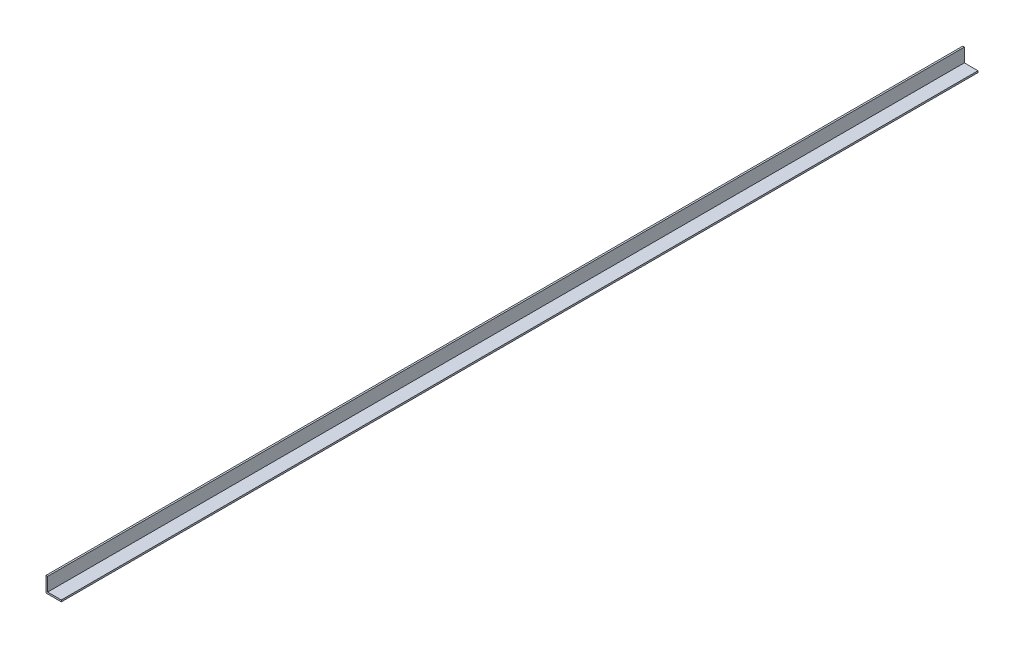
from build123d import *

# Parameters (mm, degrees)
SALIENTE_EXTRUIR1_DEPTH = 6100


with BuildPart() as part:
    # Croquis1 → Saliente-Extruir1 (new body)
    with BuildSketch(Plane.XY):
        Polygon((0, 102), (0, 0), (102, 0), (102, 11.1), (11.1, 11.1), (11.1, 102), align=None)
    extrude(amount=-SALIENTE_EXTRUIR1_DEPTH)


solid = part.part
